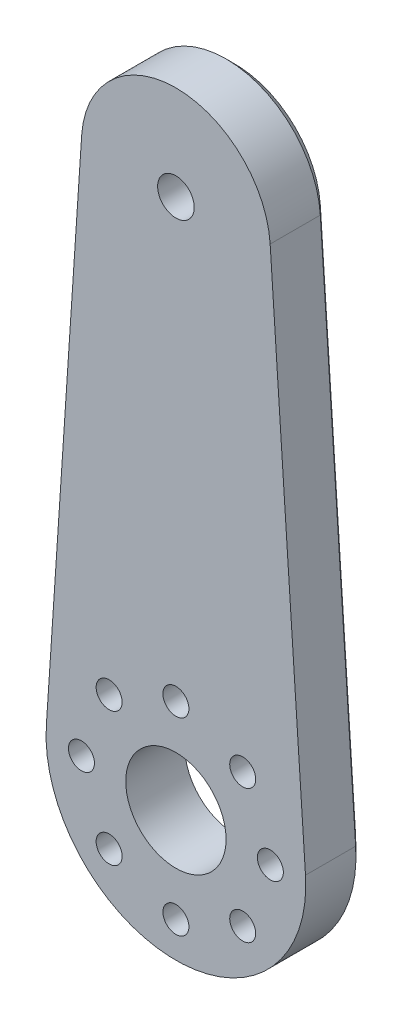
from build123d import *

# Parameters (mm, degrees)
SKETCH1_R           = 1.55
SKETCH1_R_2         = 4.25
SKETCH1_R_3         = 1.1
BOSS_EXTRUDE1_DEPTH = 5
CUT_EXTRUDE2_DEPTH  = 2
SKETCH4_R           = 1.75
CUT_EXTRUDE3_DEPTH  = 2.25
CHAFL_N1_SIZE       = 0.75


with BuildPart() as part:
    # Sketch1 → Boss-Extrude1 (new body)
    with BuildSketch(Plane.XY):
        with BuildLine():
            Line((-23.115842036, 26.376096398), (-26.109167946, -18.423903602))
            ThreePointArc((-26.109167946, -18.423903602), (-15.133639611, -30.157236935), (-4.158111277, -18.423903602))
            Line((-4.158111277, -18.423903602), (-7.151437186, 26.376096398))
            ThreePointArc((-7.151437186, 26.376096398), (-15.133639611, 33.842763065), (-23.115842036, 26.376096398))
        make_face()
        with Locations((-15.133639611, 25.842763065)):
            Circle(SKETCH1_R, mode=Mode.SUBTRACT)
        with Locations((-15.133639611, -19.157236935)):
            Circle(SKETCH1_R_2, mode=Mode.SUBTRACT)
        with Locations((-7.133639611, -19.157236935)):
            Circle(SKETCH1_R_3, mode=Mode.SUBTRACT)
        with Locations((-9.476785362, -24.814091185)):
            Circle(SKETCH1_R_3, mode=Mode.SUBTRACT)
        with Locations((-15.133639611, -27.157236935)):
            Circle(SKETCH1_R_3, mode=Mode.SUBTRACT)
        with Locations((-20.790493861, -24.814091185)):
            Circle(SKETCH1_R_3, mode=Mode.SUBTRACT)
        with Locations((-23.133639611, -19.157236935)):
            Circle(SKETCH1_R_3, mode=Mode.SUBTRACT)
        with Locations((-20.790493861, -13.500382686)):
            Circle(SKETCH1_R_3, mode=Mode.SUBTRACT)
        with Locations((-15.133639611, -11.157236935)):
            Circle(SKETCH1_R_3, mode=Mode.SUBTRACT)
        with Locations((-9.476785362, -13.500382686)):
            Circle(SKETCH1_R_3, mode=Mode.SUBTRACT)
    extrude(amount=BOSS_EXTRUDE1_DEPTH)

    # Sketch3 → Cut-Extrude2 (cut)
    with BuildSketch(Plane.XY):
        Polygon((-13.545926371, 23.092763065), (-11.958213131, 25.842763065), (-13.545926371, 28.592763065), (-16.721352851, 28.592763065), (-18.309066092, 25.842763065), (-16.721352851, 23.092763065), align=None)
    extrude(amount=CUT_EXTRUDE2_DEPTH, mode=Mode.SUBTRACT)

    # Sketch4 → Cut-Extrude3 (cut)
    with BuildSketch(Plane(origin=(0, 0, 0), x_dir=(-1, 0, 0), z_dir=(0, 0, -1))):
        with Locations((23.133639611, -19.157236935)):
            Circle(SKETCH4_R)
        with Locations((20.790493861, -24.814091185)):
            Circle(SKETCH4_R)
        with Locations((15.133639611, -27.157236935)):
            Circle(SKETCH4_R)
        with Locations((9.476785362, -24.814091185)):
            Circle(SKETCH4_R)
        with Locations((7.133639611, -19.157236935)):
            Circle(SKETCH4_R)
        with Locations((9.476785362, -13.500382686)):
            Circle(SKETCH4_R)
        with Locations((15.133639611, -11.157236935)):
            Circle(SKETCH4_R)
        with Locations((20.790493861, -13.500382686)):
            Circle(SKETCH4_R)
    extrude(amount=-CUT_EXTRUDE3_DEPTH, mode=Mode.SUBTRACT)

    # Chaflán1
    chafl_n1_edges = [part.edges().sort_by_distance(p)[0] for p in [
        (-5.654774231, 3.976096398, 0),
        (-15.133639611, -30.157236935, 0),
        (-24.612504991, 3.976096398, 0),
        (-15.133639611, 33.842763065, 0),
    ]]
    chamfer(chafl_n1_edges, length=CHAFL_N1_SIZE)


solid = part.part
